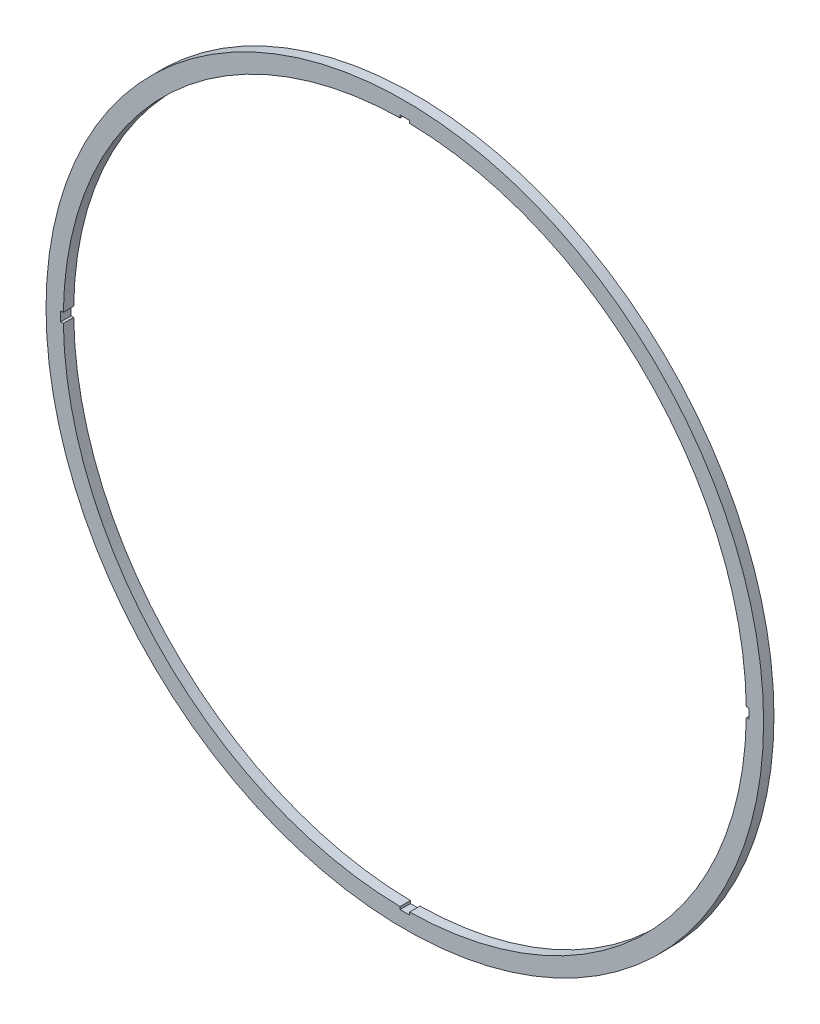
from build123d import *

# Parameters (mm, degrees)
SKETCH1_R           = 415
BOSS_EXTRUDE1_DEPTH = 12


with BuildPart() as part:
    # Sketch1 → Boss-Extrude1 (new body)
    with BuildSketch(Plane.XY):
        Circle(SKETCH1_R)
        with BuildLine():
            Line((398.003407413, 5.511627907), (394.96154491, 5.511627907))
            ThreePointArc((394.96154491, 5.511627907), (279.307178569, 279.307178569), (5.511627907, 394.96154491))
            Line((5.511627907, 394.96154491), (5.511627907, 398.003407413))
            Line((5.511627907, 398.003407413), (-5.511627907, 398.003407413))
            Line((-5.511627907, 398.003407413), (-5.511627907, 394.96154491))
            ThreePointArc((-5.511627907, 394.96154491), (-279.307178569, 279.307178569), (-394.96154491, 5.511627907))
            Line((-394.96154491, 5.511627907), (-398.003407413, 5.511627907))
            Line((-398.003407413, 5.511627907), (-398.003407413, -5.511627907))
            Line((-398.003407413, -5.511627907), (-394.96154491, -5.511627907))
            ThreePointArc((-394.96154491, -5.511627907), (-279.307178569, -279.307178569), (-5.511627907, -394.96154491))
            Line((-5.511627907, -394.96154491), (-5.511627907, -398.003407413))
            Line((-5.511627907, -398.003407413), (5.511627907, -398.003407413))
            Line((5.511627907, -398.003407413), (5.511627907, -394.96154491))
            ThreePointArc((5.511627907, -394.96154491), (279.307178569, -279.307178569), (394.96154491, -5.511627907))
            Line((394.96154491, -5.511627907), (398.003407413, -5.511627907))
            Line((398.003407413, -5.511627907), (398.003407413, 5.511627907))
        make_face(mode=Mode.SUBTRACT)
    extrude(amount=BOSS_EXTRUDE1_DEPTH)


solid = part.part
